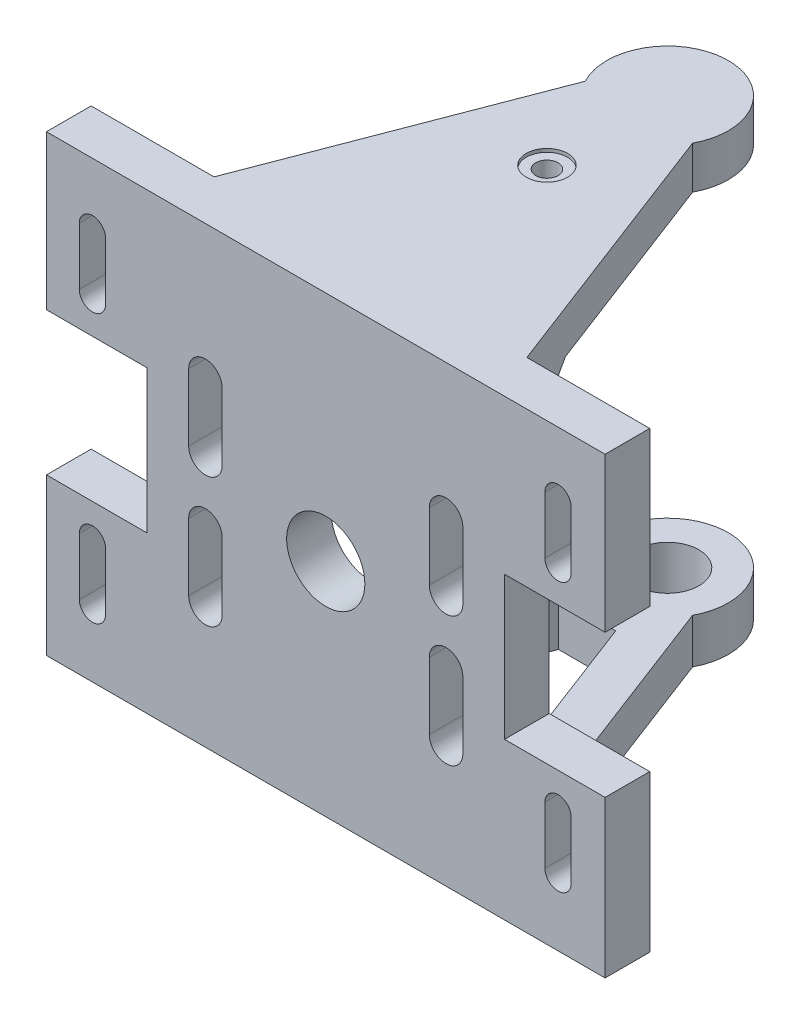
from build123d import *

# Parameters (mm, degrees)
ESBO_O1_R                                           = 3.5
RESSALTO_EXTRUS_O3_DEPTH                            = 2
ESBO_O3_R                                           = 2.8
RESSALTO_EXTRUS_O4_DEPTH                            = 4
RESSALTO_EXTRUS_O6_START                            = -3.8
RESSALTO_EXTRUS_O6_DEPTH                            = 3.8
ESBO_O1_2_R                                         = 3.5
RESSALTO_EXTRUS_O7_DEPTH                            = 4
CORTE_EXTRUS_O1_DEPTH                               = 1.8
ESBO_O12_R                                          = 1
CORTE_EXTRUS_O2_DEPTH                               = 99.628595452
REBAIXO_PARA_PARAFUSO_COM_CABE_A_PANELA_D           = 2
REBAIXO_PARA_PARAFUSO_COM_CABE_A_PANELA_CBORE_D     = 3.7
REBAIXO_PARA_PARAFUSO_COM_CABE_A_PANELA_CBORE_DEPTH = 0.3


with BuildPart() as part:
    # Esboço1 → Ressalto-extrusão3 (new body)
    with BuildSketch(Plane.XY):
        Polygon((-84.918900929, -29.176229512), (-75.918900929, -29.176229512), (-75.918900929, -41.976229512), (-84.918900929, -41.976229512), (-84.918900929, -55.976229512), (-34.918900929, -55.976229512), (-34.918900929, -41.976229512), (-43.918900929, -41.976229512), (-43.918900929, -29.176229512), (-34.918900929, -29.176229512), (-34.918900929, -15.376229512), (-84.918900929, -15.376229512), align=None)
        with Locations((-59.918900929, -36.176229512)):
            Circle(ESBO_O1_R, mode=Mode.SUBTRACT)
        with BuildLine():
            Line((-79.628633502, -20.989452457), (-79.628633502, -26.118287824))
            ThreePointArc((-79.628633502, -26.118287824), (-80.802509211, -27.292163532), (-81.97638492, -26.118287824))
            Line((-81.97638492, -26.118287824), (-81.97638492, -20.989452457))
            ThreePointArc((-81.97638492, -20.989452457), (-80.802509211, -19.815576748), (-79.628633502, -20.989452457))
        make_face(mode=Mode.SUBTRACT)
        with BuildLine():
            Line((-69.188165399, -27.376229512), (-69.188165399, -33.376229512))
            ThreePointArc((-69.188165399, -33.376229512), (-70.688165399, -34.876229512), (-72.188165399, -33.376229512))
            Line((-72.188165399, -33.376229512), (-72.188165399, -27.376229512))
            ThreePointArc((-72.188165399, -27.376229512), (-70.688165399, -25.876229512), (-69.188165399, -27.376229512))
        make_face(mode=Mode.SUBTRACT)
        with BuildLine():
            Line((-79.628633502, -50.166860599), (-79.628633502, -45.038025232))
            ThreePointArc((-79.628633502, -45.038025232), (-80.802509211, -43.864149523), (-81.97638492, -45.038025232))
            Line((-81.97638492, -45.038025232), (-81.97638492, -50.166860599))
            ThreePointArc((-81.97638492, -50.166860599), (-80.802509211, -51.340736308), (-79.628633502, -50.166860599))
        make_face(mode=Mode.SUBTRACT)
        with BuildLine():
            Line((-40.301250748, -20.989452457), (-40.301250748, -26.118287824))
            ThreePointArc((-40.301250748, -26.118287824), (-39.12737504, -27.292163532), (-37.953499331, -26.118287824))
            Line((-37.953499331, -26.118287824), (-37.953499331, -20.989452457))
            ThreePointArc((-37.953499331, -20.989452457), (-39.12737504, -19.815576748), (-40.301250748, -20.989452457))
        make_face(mode=Mode.SUBTRACT)
        with BuildLine():
            Line((-40.301250748, -50.166860599), (-40.301250748, -45.038025232))
            ThreePointArc((-40.301250748, -45.038025232), (-39.12737504, -43.864149523), (-37.953499331, -45.038025232))
            Line((-37.953499331, -45.038025232), (-37.953499331, -50.166860599))
            ThreePointArc((-37.953499331, -50.166860599), (-39.12737504, -51.340736308), (-40.301250748, -50.166860599))
        make_face(mode=Mode.SUBTRACT)
        with BuildLine():
            Line((-69.188165399, -44.976229512), (-69.188165399, -38.976229512))
            ThreePointArc((-69.188165399, -38.976229512), (-70.688165399, -37.476229512), (-72.188165399, -38.976229512))
            Line((-72.188165399, -38.976229512), (-72.188165399, -44.976229512))
            ThreePointArc((-72.188165399, -44.976229512), (-70.688165399, -46.476229512), (-69.188165399, -44.976229512))
        make_face(mode=Mode.SUBTRACT)
        with BuildLine():
            Line((-50.649636459, -44.976229512), (-50.649636459, -38.976229512))
            ThreePointArc((-50.649636459, -38.976229512), (-49.149636459, -37.476229512), (-47.649636459, -38.976229512))
            Line((-47.649636459, -38.976229512), (-47.649636459, -44.976229512))
            ThreePointArc((-47.649636459, -44.976229512), (-49.149636459, -46.476229512), (-50.649636459, -44.976229512))
        make_face(mode=Mode.SUBTRACT)
        with BuildLine():
            Line((-50.649636459, -27.376229512), (-50.649636459, -33.376229512))
            ThreePointArc((-50.649636459, -33.376229512), (-49.149636459, -34.876229512), (-47.649636459, -33.376229512))
            Line((-47.649636459, -33.376229512), (-47.649636459, -27.376229512))
            ThreePointArc((-47.649636459, -27.376229512), (-49.149636459, -25.876229512), (-50.649636459, -27.376229512))
        make_face(mode=Mode.SUBTRACT)
    extrude(amount=RESSALTO_EXTRUS_O3_DEPTH)

    # Esboço3 → Ressalto-extrusão4 (add)
    with BuildSketch(Plane.XZ.offset(55.976229512)):
        with BuildLine():
            Line((-69.918900929, 0), (-49.918900929, 0))
            Line((-49.918900929, 0), (-45.918900929, 0))
            Line((-45.918900929, 0), (-53.068900929, -18.682538503))
            Line((-53.068900929, -18.682538503), (-55.116153158, -24.031890755))
            ThreePointArc((-55.116153158, -24.031890755), (-59.917574185, -32.037791837), (-64.718995211, -24.031890755))
            Line((-64.718995211, -24.031890755), (-66.76683809, -18.682538503))
            Line((-66.76683809, -18.682538503), (-73.918900929, 0))
            Line((-73.918900929, 0), (-69.918900929, 0))
        make_face()
        with Locations((-59.917574185, -26.595050595)):
            Circle(ESBO_O3_R, mode=Mode.SUBTRACT)
        Polygon((-66.76683809, -8.203857571), (-64.418900929, -14.314821419), (-62.472202165, -19.381484176), (-57.350495612, -19.381484176), (-55.418900929, -14.314821419), (-53.089180985, -8.203857571), align=None, mode=Mode.SUBTRACT)
    extrude(amount=-RESSALTO_EXTRUS_O4_DEPTH)

    # Esboço4 → Ressalto-extrusão6 (add)
    with BuildSketch(Plane(origin=(0, -15.376229512, 0), x_dir=(1, 0, 0), z_dir=(0, 1, 0)).offset(RESSALTO_EXTRUS_O6_START)):
        with BuildLine():
            Line((-73.918900929, 0), (-64.718995211, 24.031890755))
            ThreePointArc((-64.718995211, 24.031890755), (-59.917574185, 32.037791837), (-55.116153158, 24.031890755))
            Line((-55.116153158, 24.031890755), (-45.918900929, 0))
            Line((-45.918900929, 0), (-49.918900929, 0))
            Line((-49.918900929, 0), (-69.918900929, 0))
            Line((-69.918900929, 0), (-73.918900929, 0))
        make_face()
    extrude(amount=RESSALTO_EXTRUS_O6_DEPTH)

    # Esboço1<2> → Ressalto-extrusão7 (add)
    with BuildSketch(Plane.XY):
        Polygon((-84.918900929, -29.176229512), (-75.918900929, -29.176229512), (-75.918900929, -41.976229512), (-84.918900929, -41.976229512), (-84.918900929, -55.976229512), (-34.918900929, -55.976229512), (-34.918900929, -41.976229512), (-43.918900929, -41.976229512), (-43.918900929, -29.176229512), (-34.918900929, -29.176229512), (-34.918900929, -15.376229512), (-84.918900929, -15.376229512), align=None)
        with Locations((-59.918900929, -36.176229512)):
            Circle(ESBO_O1_2_R, mode=Mode.SUBTRACT)
        with BuildLine():
            Line((-79.628633502, -20.989452457), (-79.628633502, -26.118287824))
            ThreePointArc((-79.628633502, -26.118287824), (-80.802509211, -27.292163532), (-81.97638492, -26.118287824))
            Line((-81.97638492, -26.118287824), (-81.97638492, -20.989452457))
            ThreePointArc((-81.97638492, -20.989452457), (-80.802509211, -19.815576748), (-79.628633502, -20.989452457))
        make_face(mode=Mode.SUBTRACT)
        with BuildLine():
            Line((-69.188165399, -27.376229512), (-69.188165399, -33.376229512))
            ThreePointArc((-69.188165399, -33.376229512), (-70.688165399, -34.876229512), (-72.188165399, -33.376229512))
            Line((-72.188165399, -33.376229512), (-72.188165399, -27.376229512))
            ThreePointArc((-72.188165399, -27.376229512), (-70.688165399, -25.876229512), (-69.188165399, -27.376229512))
        make_face(mode=Mode.SUBTRACT)
        with BuildLine():
            Line((-79.628633502, -50.166860599), (-79.628633502, -45.038025232))
            ThreePointArc((-79.628633502, -45.038025232), (-80.802509211, -43.864149523), (-81.97638492, -45.038025232))
            Line((-81.97638492, -45.038025232), (-81.97638492, -50.166860599))
            ThreePointArc((-81.97638492, -50.166860599), (-80.802509211, -51.340736308), (-79.628633502, -50.166860599))
        make_face(mode=Mode.SUBTRACT)
        with BuildLine():
            Line((-40.301250748, -20.989452457), (-40.301250748, -26.118287824))
            ThreePointArc((-40.301250748, -26.118287824), (-39.12737504, -27.292163532), (-37.953499331, -26.118287824))
            Line((-37.953499331, -26.118287824), (-37.953499331, -20.989452457))
            ThreePointArc((-37.953499331, -20.989452457), (-39.12737504, -19.815576748), (-40.301250748, -20.989452457))
        make_face(mode=Mode.SUBTRACT)
        with BuildLine():
            Line((-40.301250748, -50.166860599), (-40.301250748, -45.038025232))
            ThreePointArc((-40.301250748, -45.038025232), (-39.12737504, -43.864149523), (-37.953499331, -45.038025232))
            Line((-37.953499331, -45.038025232), (-37.953499331, -50.166860599))
            ThreePointArc((-37.953499331, -50.166860599), (-39.12737504, -51.340736308), (-40.301250748, -50.166860599))
        make_face(mode=Mode.SUBTRACT)
        with BuildLine():
            Line((-69.188165399, -44.976229512), (-69.188165399, -38.976229512))
            ThreePointArc((-69.188165399, -38.976229512), (-70.688165399, -37.476229512), (-72.188165399, -38.976229512))
            Line((-72.188165399, -38.976229512), (-72.188165399, -44.976229512))
            ThreePointArc((-72.188165399, -44.976229512), (-70.688165399, -46.476229512), (-69.188165399, -44.976229512))
        make_face(mode=Mode.SUBTRACT)
        with BuildLine():
            Line((-50.649636459, -44.976229512), (-50.649636459, -38.976229512))
            ThreePointArc((-50.649636459, -38.976229512), (-49.149636459, -37.476229512), (-47.649636459, -38.976229512))
            Line((-47.649636459, -38.976229512), (-47.649636459, -44.976229512))
            ThreePointArc((-47.649636459, -44.976229512), (-49.149636459, -46.476229512), (-50.649636459, -44.976229512))
        make_face(mode=Mode.SUBTRACT)
        with BuildLine():
            Line((-50.649636459, -27.376229512), (-50.649636459, -33.376229512))
            ThreePointArc((-50.649636459, -33.376229512), (-49.149636459, -34.876229512), (-47.649636459, -33.376229512))
            Line((-47.649636459, -33.376229512), (-47.649636459, -27.376229512))
            ThreePointArc((-47.649636459, -27.376229512), (-49.149636459, -25.876229512), (-50.649636459, -27.376229512))
        make_face(mode=Mode.SUBTRACT)
    extrude(amount=RESSALTO_EXTRUS_O7_DEPTH)

    # Esboço5 → Corte-extrusão1 (cut)
    with BuildSketch(Plane.XZ.offset(19.176229512)):
        with BuildLine():
            Line((-62.417574185, -11.645050595), (-64.067574185, -26.595050595))
            ThreePointArc((-64.067574185, -26.595050595), (-59.917574185, -30.745050595), (-55.767574185, -26.595050595))
            Line((-55.767574185, -26.595050595), (-57.417574185, -11.645050595))
            ThreePointArc((-57.417574185, -11.645050595), (-59.917574185, -9.145050595), (-62.417574185, -11.645050595))
        make_face()
    extrude(amount=-CORTE_EXTRUS_O1_DEPTH, mode=Mode.SUBTRACT)

    # Esboço12 → Corte-extrusão2 (cut, through all)
    with BuildSketch(Plane.XZ.offset(17.376229512)):
        with Locations((-59.917574185, -15.795050595)):
            Circle(ESBO_O12_R)
    extrude(amount=-CORTE_EXTRUS_O2_DEPTH, mode=Mode.SUBTRACT)

    # Rebaixo para parafuso com cabeça panela de M1.62 (through all)
    with Locations(Plane(origin=(0, -15.376229512, 0), x_dir=(1, 0, 0), z_dir=(0, 1, 0))):
        with Locations((-59.917574185, 15.795050595)):
            CounterBoreHole(REBAIXO_PARA_PARAFUSO_COM_CABE_A_PANELA_D / 2, REBAIXO_PARA_PARAFUSO_COM_CABE_A_PANELA_CBORE_D / 2, REBAIXO_PARA_PARAFUSO_COM_CABE_A_PANELA_CBORE_DEPTH)

    # Esboço19 → Loft1 section 0
    with BuildSketch(Plane(origin=(-40.052521208, 0, 15.328512589), x_dir=(-0.35742863536508446, 0, -0.9339404534664153), z_dir=(0.9339404534664153, 0, -0.35742863536508446))):
        with BuildLine():
            Line((22.412730097, -19.176229512), (16.412730097, -23.176229512))
            Line((16.412730097, -23.176229512), (16.412730097, -19.176229512))
            Line((16.412730097, -19.176229512), (22.412730097, -19.176229512))
        make_face()
    # Esboço21 → Loft1 section 1
    with BuildSketch(Plane(origin=(-64.470621516, 0, -24.68068974), x_dir=(-0.35751857745188526, 0, 0.9339060267375837), z_dir=(-0.9339060267375838, 0, -0.35751857745188526))):
        with BuildLine():
            Line((20.427380307, -19.176229512), (26.427380307, -23.176229512))
            Line((26.427380307, -23.176229512), (26.427380307, -19.176229512))
            Line((26.427380307, -19.176229512), (20.427380307, -19.176229512))
        make_face()
    loft()

    # Esboço25 → Loft2 section 0
    with BuildSketch(Plane(origin=(-40.052521208, 0, 15.328512589), x_dir=(-0.3574286353650846, 0, -0.9339404534664153), z_dir=(0.9339404534664153, 0, -0.3574286353650846))):
        with BuildLine():
            Line((16.412730097, -51.976229512), (16.412730097, -47.976229512))
            Line((16.412730097, -47.976229512), (22.412730097, -51.976229512))
            Line((22.412730097, -51.976229512), (16.412730097, -51.976229512))
        make_face()
    # Esboço24 → Loft2 section 1
    with BuildSketch(Plane(origin=(-64.470621516, 0, -24.68068974), x_dir=(-0.3575185774518854, 0, 0.9339060267375836), z_dir=(-0.9339060267375836, 0, -0.3575185774518854))):
        with BuildLine():
            Line((26.427380307, -51.976229512), (26.427380307, -47.976229512))
            Line((26.427380307, -47.976229512), (20.427380307, -51.976229512))
            Line((20.427380307, -51.976229512), (26.427380307, -51.976229512))
        make_face()
    loft()


solid = part.part
